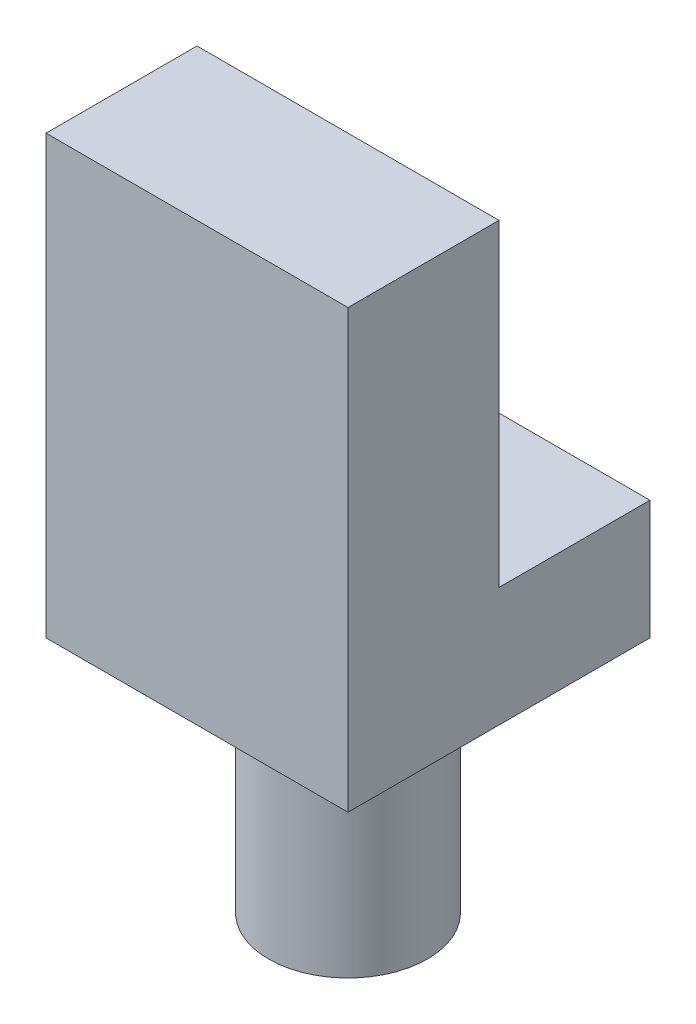
from build123d import *

# Parameters (mm, degrees)
SKETCH1_R           = 10
BOSS_EXTRUDE1_DEPTH = 30
SKETCH2_W           = 38
SKETCH2_H           = 38
BOSS_EXTRUDE2_DEPTH = 15
SKETCH3_W           = 38
SKETCH3_H           = 19
BOSS_EXTRUDE3_DEPTH = 40


with BuildPart() as part:
    # Sketch1 → Boss-Extrude1 (new body)
    with BuildSketch(Plane(origin=(0, 0, 0), x_dir=(1, 0, 0), z_dir=(0, 1, 0))):
        with Locations(Location((0, 0, 0), (0, 0, 270))):
            Circle(SKETCH1_R)
    extrude(amount=BOSS_EXTRUDE1_DEPTH)

    # Sketch2 → Boss-Extrude2 (add)
    with BuildSketch(Plane(origin=(0, 30, 0), x_dir=(1, 0, 0), z_dir=(0, 1, 0))):
        Rectangle(SKETCH2_W, SKETCH2_H)
    extrude(amount=BOSS_EXTRUDE2_DEPTH)

    # Sketch3 → Boss-Extrude3 (add)
    with BuildSketch(Plane(origin=(0, 45, 0), x_dir=(1, 0, 0), z_dir=(0, 1, 0))):
        with Locations((0, -9.5)):
            Rectangle(SKETCH3_W, SKETCH3_H)
    extrude(amount=BOSS_EXTRUDE3_DEPTH)


solid = part.part
